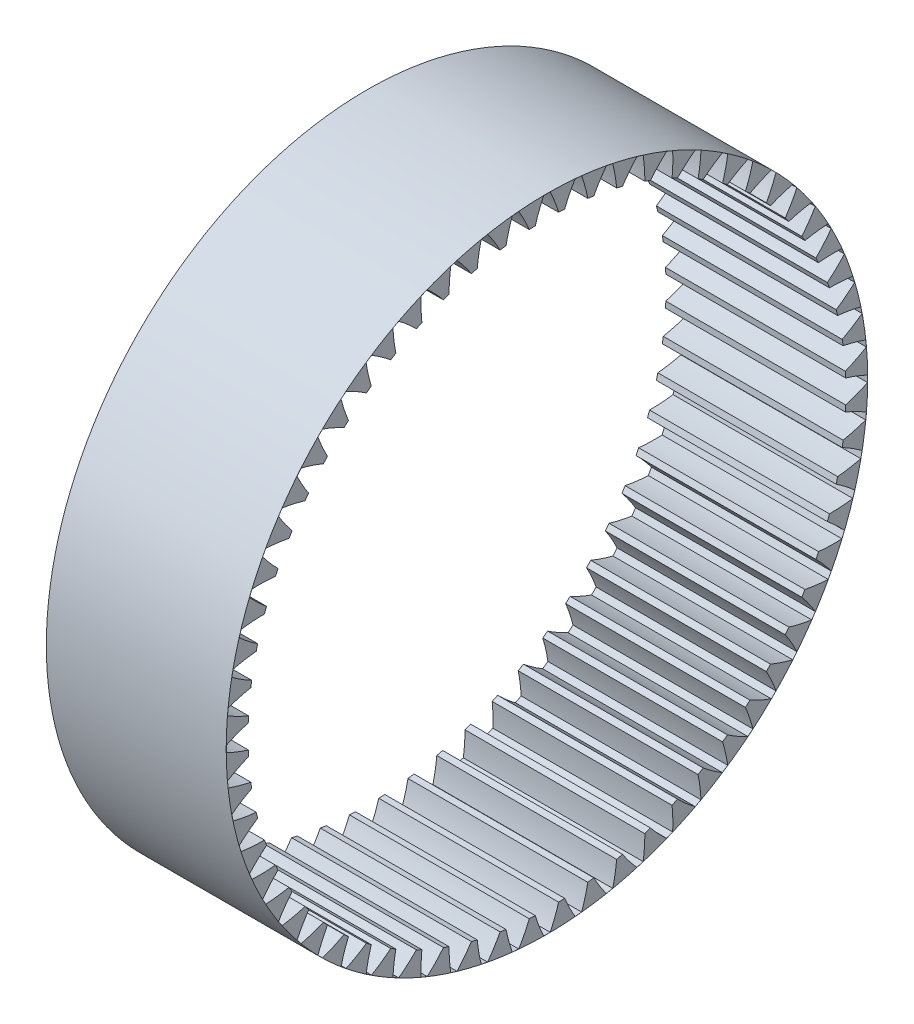
from build123d import *

# Parameters (mm, degrees)
BASPROSKE_W     = 37.3
BASPROSKE_H     = 4.5264
TOOTHCUT_DEPTH  = 102.206787292
TEETHCUTS_COUNT = 64
TEETHCUTS_ANGLE = 354.375


with BuildPart() as part:
    # BasProSke → Base-Revolve (revolve)
    with BuildSketch(Plane(origin=(0, 0, 0), x_dir=(1, 0, 0), z_dir=(0, 1, 0)), mode=Mode.PRIVATE) as base_revolve_sk:
        with Locations((18.65, 64.2632)):
            Rectangle(BASPROSKE_W, BASPROSKE_H)
    revolve(base_revolve_sk.sketch.rotate(Axis((-10, 0, 0), (1, 0, 0)), 180), axis=Axis((-10, 0, 0), (1, 0, 0)))

    # TooCutSke → ToothCut (cut, through all)
    with BuildSketch(Plane(origin=(0, 0, 0), x_dir=(0, 0, -1), z_dir=(1, 0, 0))):
        with BuildLine():
            ThreePointArc((2.423793834, 61.927185215), (1.636344103, 64.24588717), (0.673893703, 66.497585432))
            ThreePointArc((0.673893703, 66.497585432), (0, 66.501), (-0.673893703, 66.497585432))
            ThreePointArc((-0.673893703, 66.497585432), (-1.636344103, 64.24588717), (-2.423793834, 61.927185215))
            ThreePointArc((-2.423793834, 61.927185215), (0, 61.9746), (2.423793834, 61.927185215))
        make_face()
    toothcut = extrude(amount=TOOTHCUT_DEPTH, mode=Mode.SUBTRACT)

    # TeethCuts: ToothCut ×64 about axis
    teethcuts_axis = Axis((-10, 0, 0), (1, 0, 0))
    for i in range(1, TEETHCUTS_COUNT):
        add(toothcut.rotate(teethcuts_axis, i * TEETHCUTS_ANGLE / (TEETHCUTS_COUNT - 1)), mode=Mode.SUBTRACT)


solid = part.part
